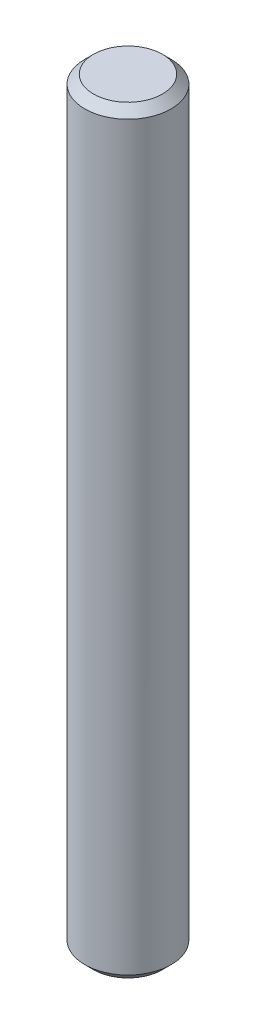
from build123d import *

# Parameters (mm, degrees)
CHAMFER_1_SIZE = 1


with BuildPart() as part:
    # 草图1 → 旋转1 (revolve)
    with BuildSketch(Plane.XY, mode=Mode.PRIVATE) as revolve_1_sk:
        Polygon((0, 44), (5, 44), (5, 29), (5, -29), (5, -44), (0, -44), align=None)
    revolve(revolve_1_sk.sketch.rotate(Axis((0, 44, 0), (0, -1, 0)), 180), axis=Axis((0, 44, 0), (0, -1, 0)))

    # 倒角1
    chamfer_1_edges = [part.edges().sort_by_distance(p)[0] for p in [
        (5, -44, 0),
        (5, 44, 0),
    ]]
    chamfer(chamfer_1_edges, length=CHAMFER_1_SIZE)


solid = part.part
